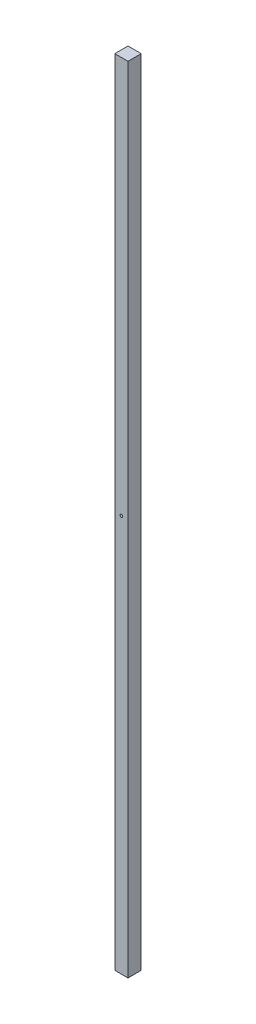
from build123d import *

# Parameters (mm, degrees)
SKETCH_1_W          = 50
SKETCH_1_H          = 50
EXTRUDE_1_DEPTH     = 3000
SKETCH_2_R          = 5
CUT_EXTRUDE_1_DEPTH = 50


with BuildPart() as part:
    # Эскиз1 → Бобышка-Вытянуть1 (new body)
    with BuildSketch(Plane(origin=(0, 0, 0), x_dir=(1, 0, 0), z_dir=(0, 1, 0))):
        Rectangle(SKETCH_1_W, SKETCH_1_H)
    extrude(amount=EXTRUDE_1_DEPTH)

    # Эскиз2 → Вырез-Вытянуть1 (cut)
    with BuildSketch(Plane.XY.offset(25)):
        with Locations((0, 1500)):
            Circle(SKETCH_2_R)
    extrude(amount=-CUT_EXTRUDE_1_DEPTH, mode=Mode.SUBTRACT)


solid = part.part
